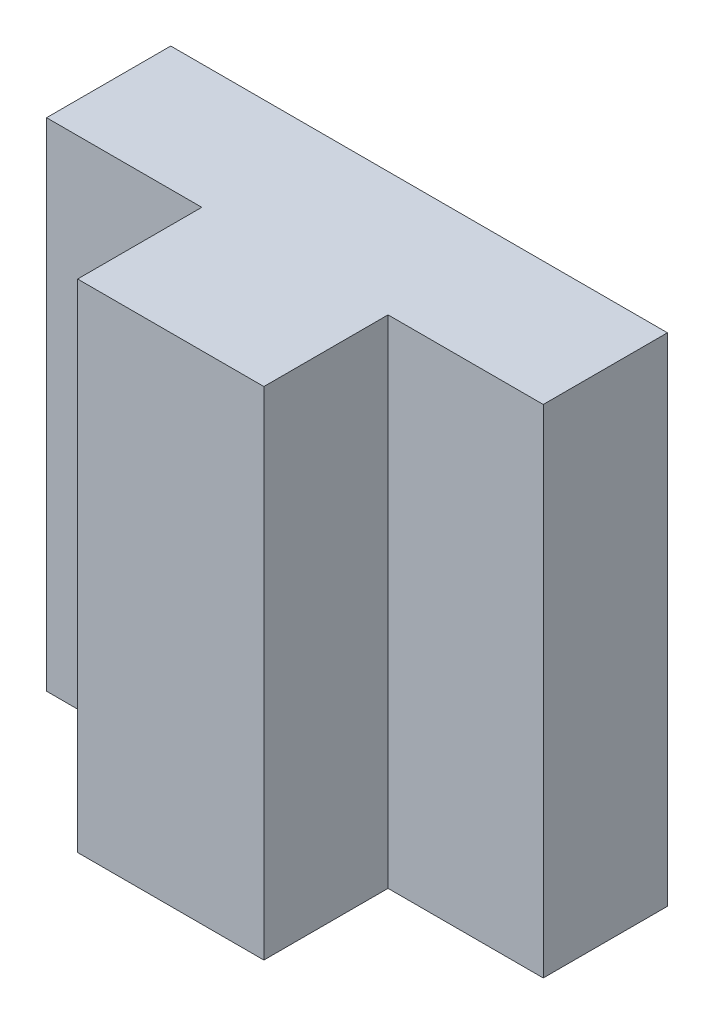
from build123d import *

# Parameters (mm, degrees)
BOSS_EXTRUDE1_DEPTH = 80


with BuildPart() as part:
    # Sketch2 → Boss-Extrude1 (new body)
    with BuildSketch(Plane(origin=(0, 0, 0), x_dir=(1, 0, 0), z_dir=(0, 1, 0))):
        Polygon((0, 0), (80, 0), (80, -20), (55, -20), (55, -40), (25, -40), (25, -20), (0, -20), align=None)
    extrude(amount=BOSS_EXTRUDE1_DEPTH)


solid = part.part
